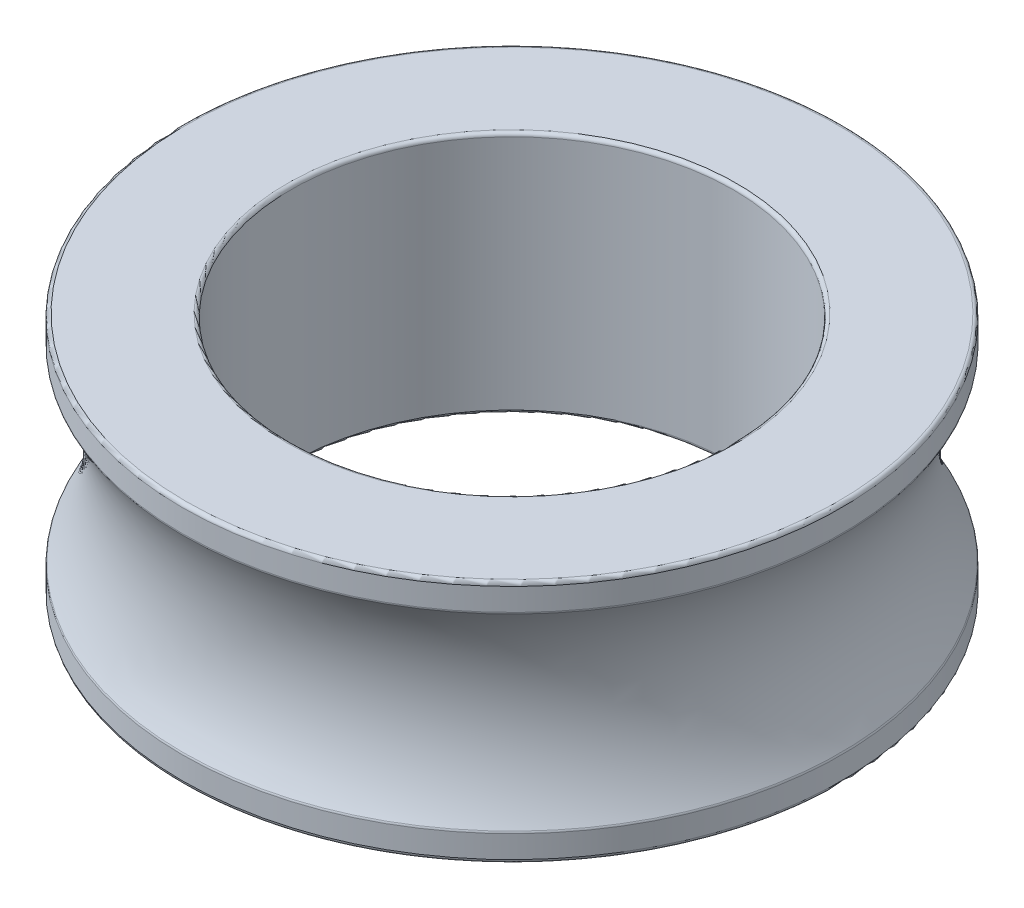
from build123d import *

# Parameters (mm, degrees)
FILLET1_R = 0.1


with BuildPart() as part:
    # Sketch1 → Revolve1 (revolve)
    with BuildSketch(Plane.XY, mode=Mode.PRIVATE) as revolve1_sk:
        with BuildLine():
            Line((9.125, 6), (9.125, 6.75))
            Line((9.125, 6.75), (6.125, 6.75))
            Line((6.125, 6.75), (6.125, 0))
            Line((6.125, 0), (9.125, 0))
            Line((9.125, 0), (9.125, 0.75))
            ThreePointArc((9.125, 0.75), (8.380511133, 3.375), (9.125, 6))
        make_face()
    revolve(revolve1_sk.sketch.rotate(Axis((0, 0, 0), (0, 1, 0)), 90), axis=Axis((0, 0, 0), (0, 1, 0)))

    # Fillet1
    fillet1_edges = [part.edges().sort_by_distance(p)[0] for p in [
        (0, 6.75, 6.125),
        (0, 6.75, 9.125),
        (0, 6, 9.125),
        (0, 0.75, 9.125),
        (0, 0, 9.125),
        (0, 0, 6.125),
    ]]
    fillet(fillet1_edges, radius=FILLET1_R)


solid = part.part
